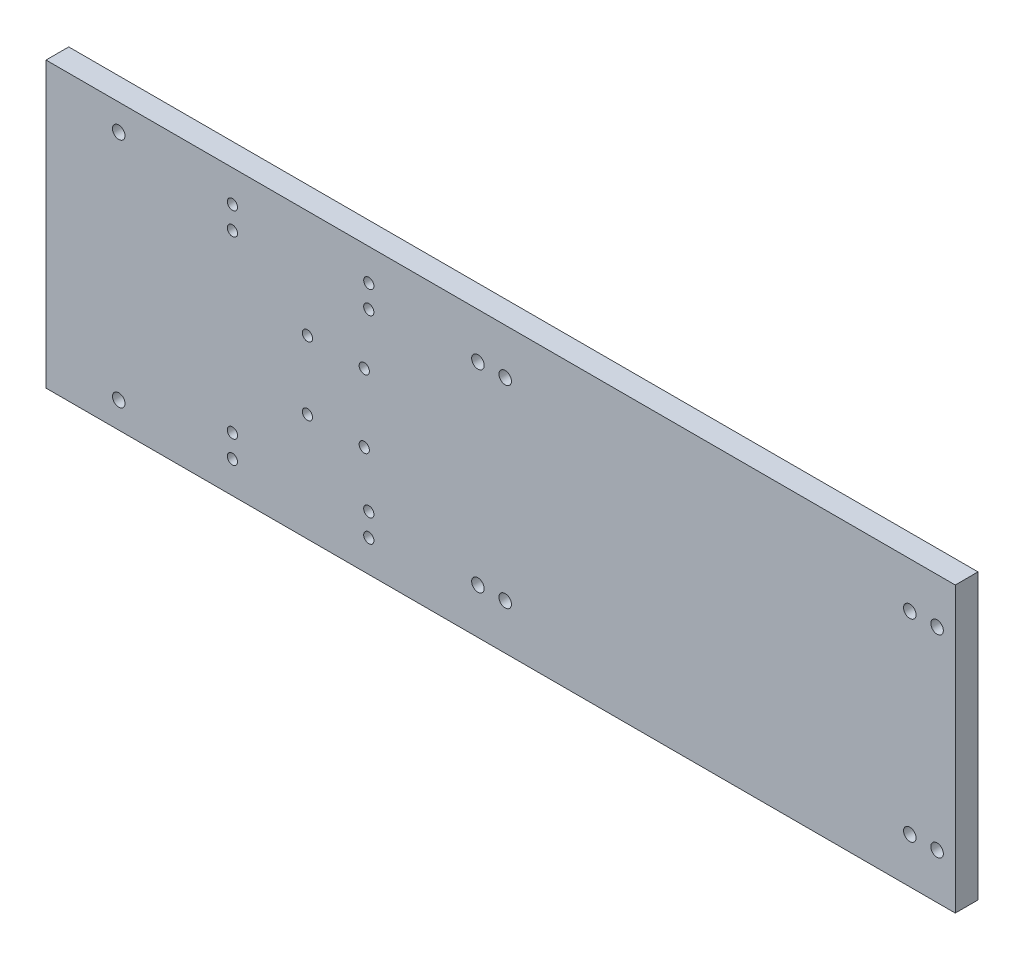
from build123d import *

# Parameters (mm, degrees)
SKETCH1_W                    = 400
SKETCH1_H                    = 125
BOSS_EXTRUDE1_DEPTH          = 10
TALADRO_DE_MARGEN_PARA_M51_D = 5.5
TALADRO_DE_MARGEN_PARA_M41_D = 4.5


with BuildPart() as part:
    # Sketch1 → Boss-Extrude1 (new body)
    with BuildSketch(Plane.XY):
        Rectangle(SKETCH1_W, SKETCH1_H)
    extrude(amount=BOSS_EXTRUDE1_DEPTH)

    # Taladro de margen para M51 (through all)
    with Locations(Plane(origin=(0, 0, 0), x_dir=(-1, 0, 0), z_dir=(0, 0, -1))):
        with Locations((-192, 42.5), (-180, 42.5), (-192, -42.5), (-180, -42.5), (-2, 42.5), (10, 42.5), (-2, -42.5), (10, -42.5), (168, 51), (168, -51)):
            Hole(TALADRO_DE_MARGEN_PARA_M51_D / 2)

    # Taladro de margen para M41 (through all)
    with Locations(Plane(origin=(0, 0, 0), x_dir=(-1, 0, 0), z_dir=(0, 0, -1))):
        with Locations((58, 38.5), (118, 38.5), (118, -38.5), (58, -38.5), (60, -15), (85, -15), (85, 15), (60, 15), (58, -48.5), (118, -48.5), (58, 48.5), (118, 48.5)):
            Hole(TALADRO_DE_MARGEN_PARA_M41_D / 2)


solid = part.part
